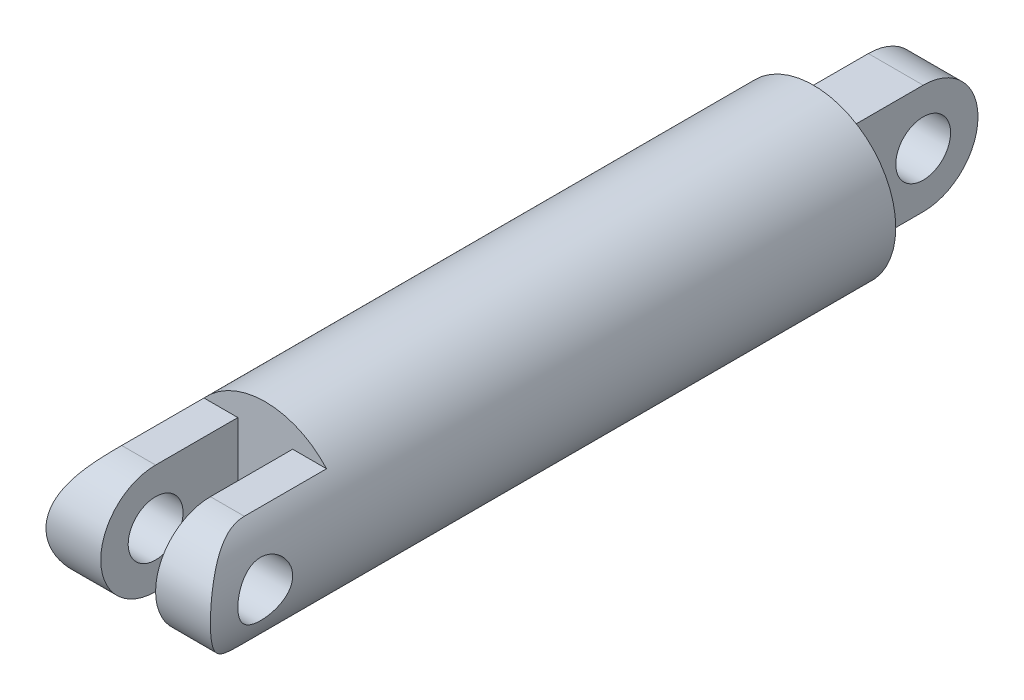
from build123d import *

# Parameters (mm, degrees)
CROQUIS1_R                   = 7.5
SALIENTE_EXTRUIR1_DEPTH      = 50
CROQUIS4_W                   = 5
CROQUIS4_H                   = 10
SALIENTE_EXTRUIR2_DEPTH      = 12.5
CROQUIS5_R                   = 2.5
CORTAR_EXTRUIR1_DEPTH        = 5
SALIENTE_EXTRUIR4_DEPTH      = 7.5
SALIENTE_EXTRUIR4_DEPTH_BACK = 7.5
CROQUIS9_R                   = 2.5
CROQUIS10_W                  = 5
CROQUIS10_H                  = 10
CORTAR_EXTRUIR2_DEPTH        = 12.5
CROQUIS11_R                  = 10
CROQUIS11_R_2                = 7.5
CORTAR_EXTRUIR3_DEPTH        = 12.5


with BuildPart() as part:
    # Croquis1 → Saliente-Extruir1 (new body)
    with BuildSketch(Plane.XY):
        Circle(CROQUIS1_R)
    extrude(amount=SALIENTE_EXTRUIR1_DEPTH)

    # Croquis4 → Saliente-Extruir2 (add)
    with BuildSketch(Plane(origin=(0, 0, 0), x_dir=(-1, 0, 0), z_dir=(0, 0, -1))):
        Rectangle(CROQUIS4_W, CROQUIS4_H)
    extrude(amount=SALIENTE_EXTRUIR2_DEPTH)

    # Croquis5 → Cortar-Extruir1 (cut)
    with BuildSketch(Plane.ZY.offset(2.5)):
        with BuildLine():
            ThreePointArc((-7.5, -5), (-11.035533906, -3.535533906), (-12.5, 0))
            Line((-12.5, 0), (-12.5, -5))
            Line((-12.5, -5), (-7.5, -5))
        make_face()
        with BuildLine():
            ThreePointArc((-12.5, 0), (-11.035533906, 3.535533906), (-7.5, 5))
            Line((-7.5, 5), (-12.5, 5))
            Line((-12.5, 5), (-12.5, 0))
        make_face()
        with Locations(Location((-7.5, 0, 0), (0, 0, 270))):
            Circle(CROQUIS5_R)
    extrude(amount=-CORTAR_EXTRUIR1_DEPTH, mode=Mode.SUBTRACT)

    # Croquis9 → Saliente-Extruir4 (add, two sides: drawn at the far end of the back side and taken through both)
    with BuildSketch(Plane(origin=(0, 0, 0), x_dir=(0, 0, -1), z_dir=(1, 0, 0)).offset(-SALIENTE_EXTRUIR4_DEPTH_BACK)):
        with BuildLine():
            Line((-50, -5), (-50, 5))
            Line((-50, 5), (-57.5, 5))
            ThreePointArc((-57.5, 5), (-61.035533906, 3.535533906), (-62.5, 0))
            ThreePointArc((-62.5, 0), (-61.035533906, -3.535533906), (-57.5, -5))
            Line((-57.5, -5), (-50, -5))
        make_face()
        with Locations((-57.5, 0)):
            Circle(CROQUIS9_R, mode=Mode.SUBTRACT)
    extrude(amount=SALIENTE_EXTRUIR4_DEPTH + SALIENTE_EXTRUIR4_DEPTH_BACK)

    # Croquis10 → Cortar-Extruir2 (cut)
    with BuildSketch(Plane.XY.offset(50)):
        Rectangle(CROQUIS10_W, CROQUIS10_H)
    extrude(amount=CORTAR_EXTRUIR2_DEPTH, mode=Mode.SUBTRACT)

    # Croquis11 → Cortar-Extruir3 (cut)
    with BuildSketch(Plane.XY.offset(50)):
        Circle(CROQUIS11_R)
        with Locations(Location((0, 0, 0), (0, 0, 221.810314896))):
            Circle(CROQUIS11_R_2, mode=Mode.SUBTRACT)
    extrude(amount=CORTAR_EXTRUIR3_DEPTH, mode=Mode.SUBTRACT)


solid = part.part
